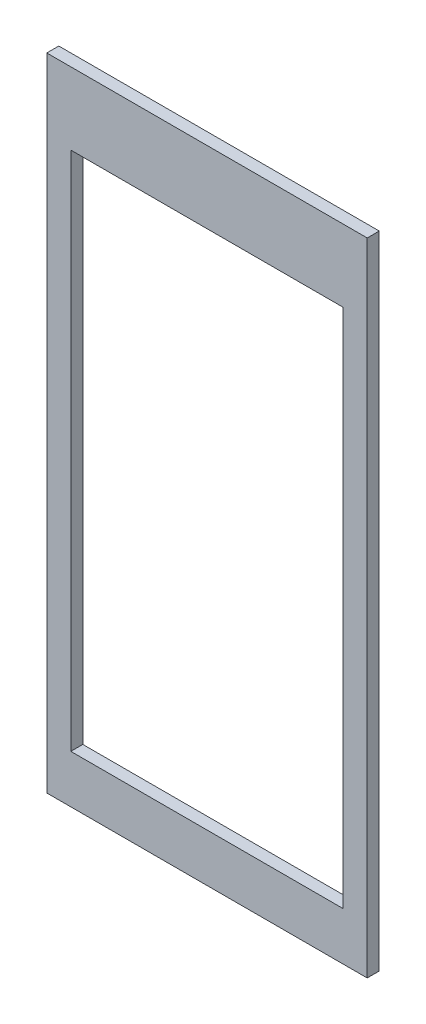
from build123d import *

# Parameters (mm, degrees)
SKETCH1_W           = 40
SKETCH1_H           = 80
BOSS_EXTRUDE1_DEPTH = 1.5
CUT_EXTRUDE1_DEPTH  = 1.5


with BuildPart() as part:
    # Sketch1 → Boss-Extrude1 (new body)
    with BuildSketch(Plane.XY):
        with Locations((20, 40)):
            Rectangle(SKETCH1_W, SKETCH1_H)
    extrude(amount=BOSS_EXTRUDE1_DEPTH)

    # Sketch2 → Cut-Extrude1 (cut)
    with BuildSketch(Plane.XY.offset(1.5)):
        Polygon((37, 71), (37, 6), (20, 6), (3, 6), (3, 71), align=None)
    extrude(amount=-CUT_EXTRUDE1_DEPTH, mode=Mode.SUBTRACT)


solid = part.part
